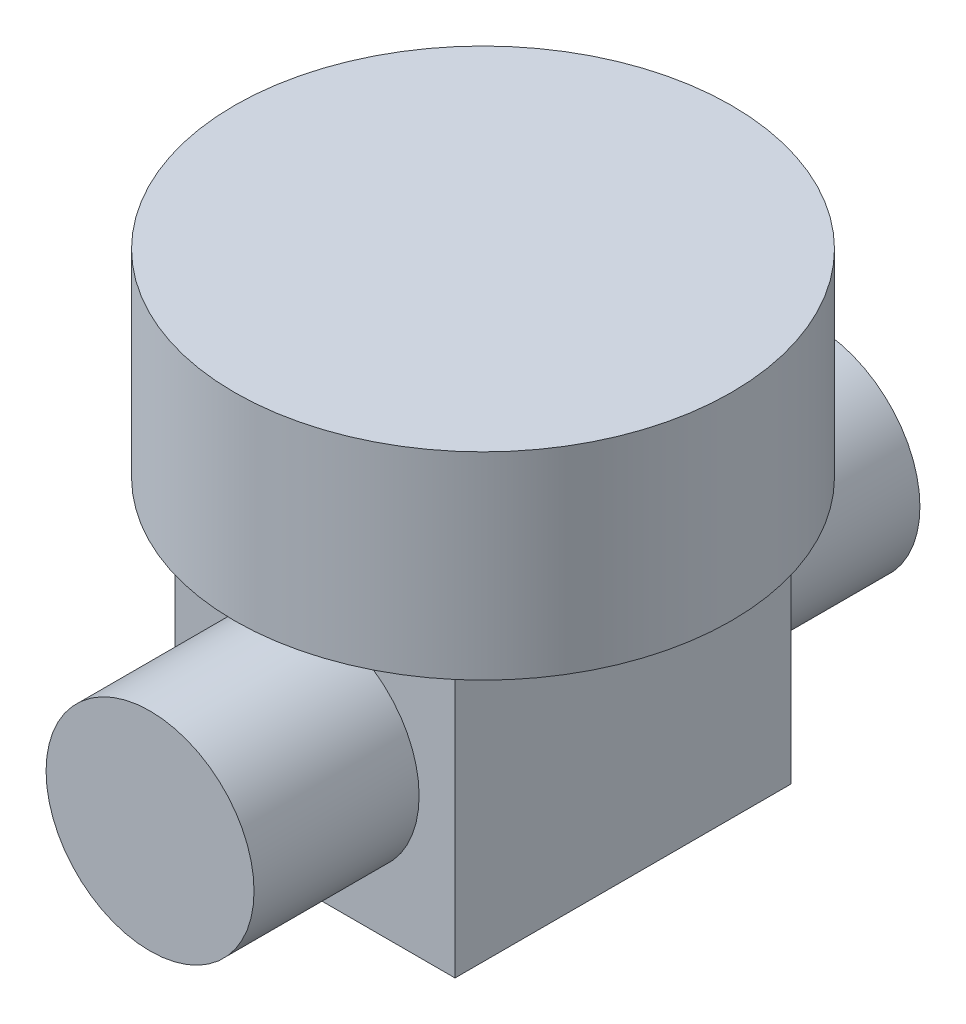
from build123d import *

# Parameters (mm, degrees)
SKETCH1_W           = 19.05
SKETCH1_H           = 22.86
BOSS_EXTRUDE1_DEPTH = 9.525
SKETCH2_R           = 16.92275
BOSS_EXTRUDE2_DEPTH = 13.462
SKETCH4_R           = 7.08025
BOSS_EXTRUDE4_DEPTH = 22.6695


with BuildPart() as part:
    # Sketch1 → Boss-Extrude1 (new, symmetric)
    with BuildSketch(Plane(origin=(0, 0, 0), x_dir=(1, 0, 0), z_dir=(0, 1, 0))):
        Rectangle(SKETCH1_W, SKETCH1_H)
    extrude(amount=BOSS_EXTRUDE1_DEPTH, both=True)

    # Sketch2 → Boss-Extrude2 (add)
    with BuildSketch(Plane(origin=(0, 9.525, 0), x_dir=(1, 0, 0), z_dir=(0, 1, 0))):
        with Locations(Location((0, 0, 0), (0, 0, 270))):
            Circle(SKETCH2_R)
    extrude(amount=BOSS_EXTRUDE2_DEPTH)

    # Sketch4 → Boss-Extrude4 (add, symmetric)
    with BuildSketch(Plane.XY):
        with Locations(Location((0, 0, 0), (0, 0, 180))):
            Circle(SKETCH4_R)
    extrude(amount=BOSS_EXTRUDE4_DEPTH, both=True)


solid = part.part
